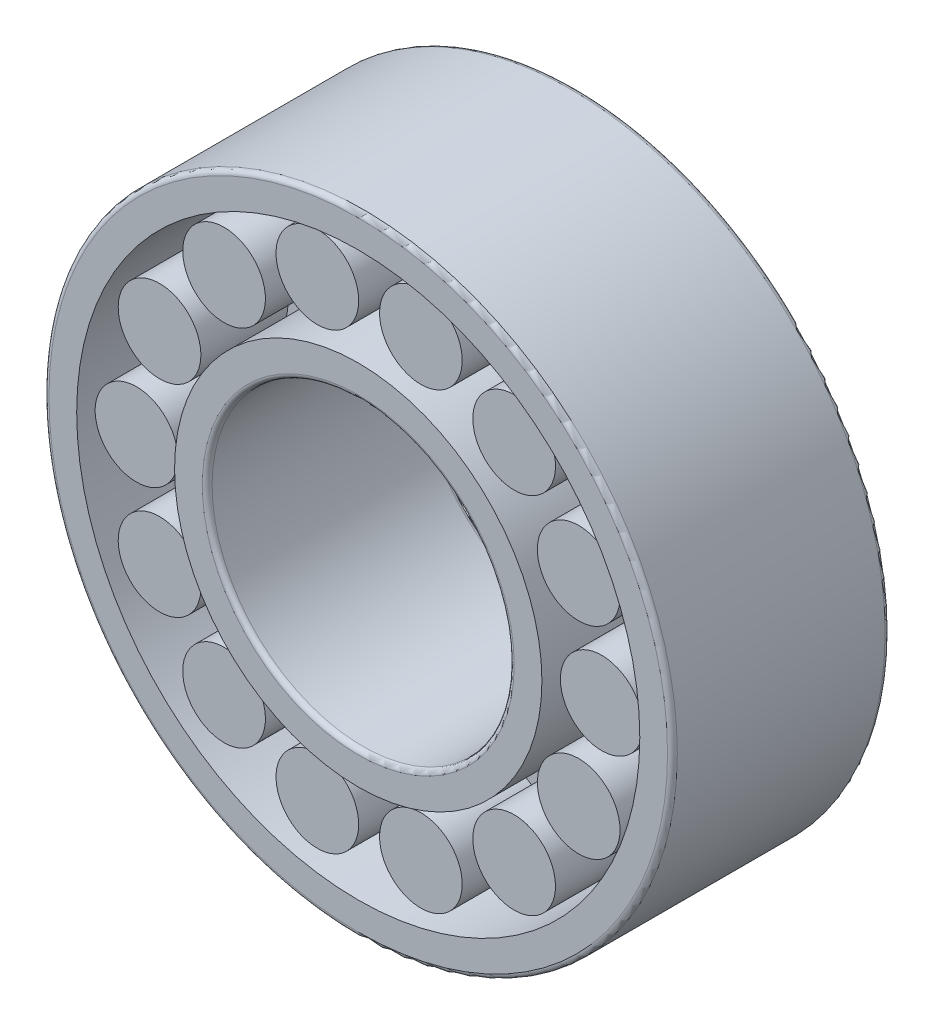
from build123d import *

# Parameters (mm, degrees)
INNERS_W              = 2.7
INNERS_H              = 18
OUTERS_W              = 2.7
OUTERS_H              = 18
ROLLER1S_W            = 3.42
ROLLER1S_H            = 7.2
ROLLER1SPATTERN_COUNT = 14
ROLLER2S_W            = 3.42
ROLLER2S_H            = 7.2
ROLLER2SPATTERN_COUNT = 14
FILLET_F1_R           = 0.405
FILLET_F2_R           = 0.405


with BuildPart() as part:
    # InnerS → InnerRing (revolve)
    with BuildSketch(Plane(origin=(0, 0, 0), x_dir=(1, 0, 0), z_dir=(0, 1, 0))):
        with Locations((13.85, 0)):
            Rectangle(INNERS_W, INNERS_H)
    revolve(axis=Axis((0, 0, 14.5), (0, 0, -1)))

    # Fillet F2
    fillet_f2_edges = [part.edges().sort_by_distance(p)[0] for p in [
        (-12.5, 0, -9),
        (-12.5, 0, 9),
    ]]
    fillet(fillet_f2_edges, radius=FILLET_F2_R)


with BuildPart() as body_2:
    # OuterS → OuterRing (revolve)
    with BuildSketch(Plane(origin=(0, 0, 0), x_dir=(1, 0, 0), z_dir=(0, 1, 0))):
        with Locations((24.65, 0)):
            Rectangle(OUTERS_W, OUTERS_H)
    revolve(axis=Axis((0, 0, 14.5), (0, 0, -1)))

    # Fillet F1
    fillet_f1_edges = [body_2.edges().sort_by_distance(p)[0] for p in [
        (-26, 0, -9),
        (-26, 0, 9),
    ]]
    fillet(fillet_f1_edges, radius=FILLET_F1_R)


with BuildPart() as body_3:
    # Roller1S → Roller1 (revolve)
    with BuildSketch(Plane(origin=(0, 0, 0), x_dir=(1, 0, 0), z_dir=(0, 1, 0))):
        with Locations((20.96, 4.5)):
            Rectangle(ROLLER1S_W, ROLLER1S_H)
    revolve(axis=Axis((19.25, 0, -8.1), (0, 0, 1)))


with BuildPart() as roller1spattern_1:
    # Roller1sPattern: pattern copy
    add(body_3.part.rotate(Axis((0, 0, -9.9), (0, 0, 1)), 1 * 360 / ROLLER1SPATTERN_COUNT))


with BuildPart() as roller1spattern_2:
    # Roller1sPattern: pattern copy
    add(body_3.part.rotate(Axis((0, 0, -9.9), (0, 0, 1)), 2 * 360 / ROLLER1SPATTERN_COUNT))


with BuildPart() as roller1spattern_3:
    # Roller1sPattern: pattern copy
    add(body_3.part.rotate(Axis((0, 0, -9.9), (0, 0, 1)), 3 * 360 / ROLLER1SPATTERN_COUNT))


with BuildPart() as roller1spattern_4:
    # Roller1sPattern: pattern copy
    add(body_3.part.rotate(Axis((0, 0, -9.9), (0, 0, 1)), 4 * 360 / ROLLER1SPATTERN_COUNT))


with BuildPart() as roller1spattern_5:
    # Roller1sPattern: pattern copy
    add(body_3.part.rotate(Axis((0, 0, -9.9), (0, 0, 1)), 5 * 360 / ROLLER1SPATTERN_COUNT))


with BuildPart() as roller1spattern_6:
    # Roller1sPattern: pattern copy
    add(body_3.part.rotate(Axis((0, 0, -9.9), (0, 0, 1)), 6 * 360 / ROLLER1SPATTERN_COUNT))


with BuildPart() as roller1spattern_7:
    # Roller1sPattern: pattern copy
    add(body_3.part.rotate(Axis((0, 0, -9.9), (0, 0, 1)), 7 * 360 / ROLLER1SPATTERN_COUNT))


with BuildPart() as roller1spattern_8:
    # Roller1sPattern: pattern copy
    add(body_3.part.rotate(Axis((0, 0, -9.9), (0, 0, 1)), 8 * 360 / ROLLER1SPATTERN_COUNT))


with BuildPart() as roller1spattern_9:
    # Roller1sPattern: pattern copy
    add(body_3.part.rotate(Axis((0, 0, -9.9), (0, 0, 1)), 9 * 360 / ROLLER1SPATTERN_COUNT))


with BuildPart() as roller1spattern_10:
    # Roller1sPattern: pattern copy
    add(body_3.part.rotate(Axis((0, 0, -9.9), (0, 0, 1)), 10 * 360 / ROLLER1SPATTERN_COUNT))


with BuildPart() as roller1spattern_11:
    # Roller1sPattern: pattern copy
    add(body_3.part.rotate(Axis((0, 0, -9.9), (0, 0, 1)), 11 * 360 / ROLLER1SPATTERN_COUNT))


with BuildPart() as roller1spattern_12:
    # Roller1sPattern: pattern copy
    add(body_3.part.rotate(Axis((0, 0, -9.9), (0, 0, 1)), 12 * 360 / ROLLER1SPATTERN_COUNT))


with BuildPart() as roller1spattern_13:
    # Roller1sPattern: pattern copy
    add(body_3.part.rotate(Axis((0, 0, -9.9), (0, 0, 1)), 13 * 360 / ROLLER1SPATTERN_COUNT))


with BuildPart() as body_17:
    # Roller2S → Roller2 (revolve)
    with BuildSketch(Plane(origin=(0, 0, 0), x_dir=(1, 0, 0), z_dir=(0, 1, 0))):
        with Locations((20.96, -4.5)):
            Rectangle(ROLLER2S_W, ROLLER2S_H)
    revolve(axis=Axis((19.25, 0, 0.9), (0, 0, 1)))


with BuildPart() as roller2spattern_1:
    # Roller2sPattern: pattern copy
    add(body_17.part.rotate(Axis((0, 0, -9.9), (0, 0, 1)), 1 * 360 / ROLLER2SPATTERN_COUNT))


with BuildPart() as roller2spattern_2:
    # Roller2sPattern: pattern copy
    add(body_17.part.rotate(Axis((0, 0, -9.9), (0, 0, 1)), 2 * 360 / ROLLER2SPATTERN_COUNT))


with BuildPart() as roller2spattern_3:
    # Roller2sPattern: pattern copy
    add(body_17.part.rotate(Axis((0, 0, -9.9), (0, 0, 1)), 3 * 360 / ROLLER2SPATTERN_COUNT))


with BuildPart() as roller2spattern_4:
    # Roller2sPattern: pattern copy
    add(body_17.part.rotate(Axis((0, 0, -9.9), (0, 0, 1)), 4 * 360 / ROLLER2SPATTERN_COUNT))


with BuildPart() as roller2spattern_5:
    # Roller2sPattern: pattern copy
    add(body_17.part.rotate(Axis((0, 0, -9.9), (0, 0, 1)), 5 * 360 / ROLLER2SPATTERN_COUNT))


with BuildPart() as roller2spattern_6:
    # Roller2sPattern: pattern copy
    add(body_17.part.rotate(Axis((0, 0, -9.9), (0, 0, 1)), 6 * 360 / ROLLER2SPATTERN_COUNT))


with BuildPart() as roller2spattern_7:
    # Roller2sPattern: pattern copy
    add(body_17.part.rotate(Axis((0, 0, -9.9), (0, 0, 1)), 7 * 360 / ROLLER2SPATTERN_COUNT))


with BuildPart() as roller2spattern_8:
    # Roller2sPattern: pattern copy
    add(body_17.part.rotate(Axis((0, 0, -9.9), (0, 0, 1)), 8 * 360 / ROLLER2SPATTERN_COUNT))


with BuildPart() as roller2spattern_9:
    # Roller2sPattern: pattern copy
    add(body_17.part.rotate(Axis((0, 0, -9.9), (0, 0, 1)), 9 * 360 / ROLLER2SPATTERN_COUNT))


with BuildPart() as roller2spattern_10:
    # Roller2sPattern: pattern copy
    add(body_17.part.rotate(Axis((0, 0, -9.9), (0, 0, 1)), 10 * 360 / ROLLER2SPATTERN_COUNT))


with BuildPart() as roller2spattern_11:
    # Roller2sPattern: pattern copy
    add(body_17.part.rotate(Axis((0, 0, -9.9), (0, 0, 1)), 11 * 360 / ROLLER2SPATTERN_COUNT))


with BuildPart() as roller2spattern_12:
    # Roller2sPattern: pattern copy
    add(body_17.part.rotate(Axis((0, 0, -9.9), (0, 0, 1)), 12 * 360 / ROLLER2SPATTERN_COUNT))


with BuildPart() as roller2spattern_13:
    # Roller2sPattern: pattern copy
    add(body_17.part.rotate(Axis((0, 0, -9.9), (0, 0, 1)), 13 * 360 / ROLLER2SPATTERN_COUNT))


solid = Compound([part.part, body_2.part, body_3.part, roller1spattern_1.part, roller1spattern_2.part, roller1spattern_3.part, roller1spattern_4.part, roller1spattern_5.part, roller1spattern_6.part, roller1spattern_7.part, roller1spattern_8.part, roller1spattern_9.part, roller1spattern_10.part, roller1spattern_11.part, roller1spattern_12.part, roller1spattern_13.part, body_17.part, roller2spattern_1.part, roller2spattern_2.part, roller2spattern_3.part, roller2spattern_4.part, roller2spattern_5.part, roller2spattern_6.part, roller2spattern_7.part, roller2spattern_8.part, roller2spattern_9.part, roller2spattern_10.part, roller2spattern_11.part, roller2spattern_12.part, roller2spattern_13.part])
